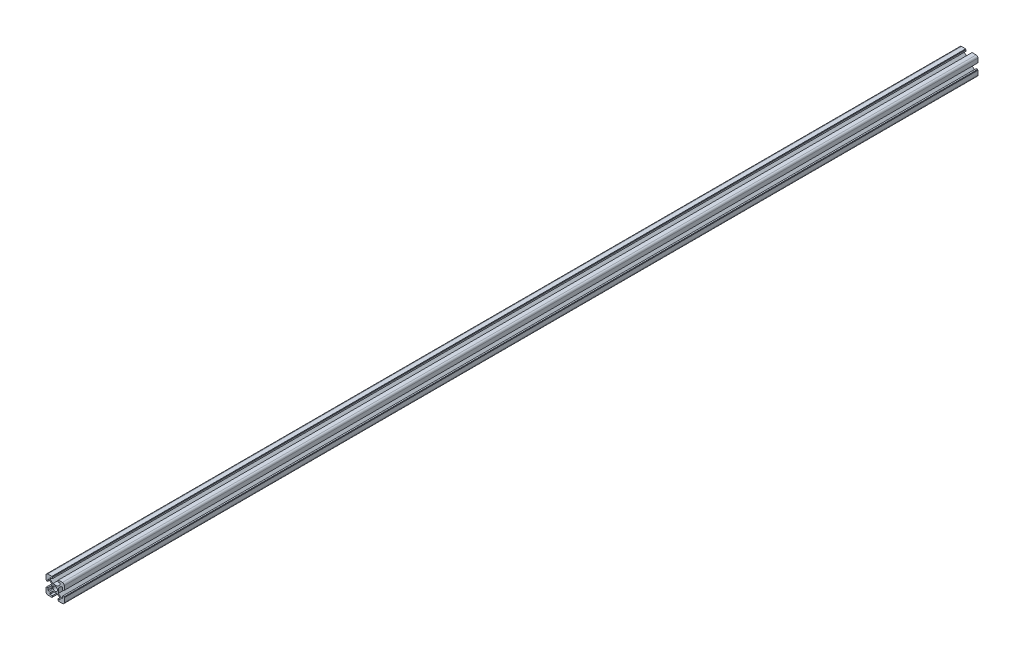
from build123d import *

# Parameters (mm, degrees)
SKETCH1_R           = 2.5
BOSS_EXTRUDE1_DEPTH = 1000


with BuildPart() as part:
    # Sketch1 → Boss-Extrude1 (new body)
    with BuildSketch(Plane.XY):
        with BuildLine():
            Line((8, -3), (8, -5.5))
            Line((8, -5.5), (6.560660172, -5.5))
            Line((6.560660172, -5.5), (3.6, -2.539339828))
            Line((3.6, -2.539339828), (3.6, 2.539339828))
            Line((3.6, 2.539339828), (6.560660172, 5.5))
            Line((6.560660172, 5.5), (8, 5.5))
            Line((8, 5.5), (8, 3))
            Line((8, 3), (9.5, 3))
            Line((9.5, 3), (9.5, 3.5))
            Line((9.5, 3.5), (10, 3.5))
            Line((10, 3.5), (10, 8))
            ThreePointArc((10, 8), (9.414213562, 9.414213562), (8, 10))
            Line((8, 10), (3.5, 10))
            Line((3.5, 10), (3.5, 9.5))
            Line((3.5, 9.5), (3, 9.5))
            Line((3, 9.5), (3, 8))
            Line((3, 8), (5.5, 8))
            Line((5.5, 8), (5.5, 6.560660172))
            Line((5.5, 6.560660172), (2.539339828, 3.6))
            Line((2.539339828, 3.6), (-2.539339828, 3.6))
            Line((-2.539339828, 3.6), (-5.5, 6.560660172))
            Line((-5.5, 6.560660172), (-5.5, 8))
            Line((-5.5, 8), (-3, 8))
            Line((-3, 8), (-3, 9.5))
            Line((-3, 9.5), (-3.5, 9.5))
            Line((-3.5, 9.5), (-3.5, 10))
            Line((-3.5, 10), (-8, 10))
            ThreePointArc((-8, 10), (-9.414213562, 9.414213562), (-10, 8))
            Line((-10, 8), (-10, 3.5))
            Line((-10, 3.5), (-9.5, 3.5))
            Line((-9.5, 3.5), (-9.5, 3))
            Line((-9.5, 3), (-8, 3))
            Line((-8, 3), (-8, 5.5))
            Line((-8, 5.5), (-6.560660172, 5.5))
            Line((-6.560660172, 5.5), (-3.6, 2.539339828))
            Line((-3.6, 2.539339828), (-3.6, -2.539339828))
            Line((-3.6, -2.539339828), (-6.560660172, -5.5))
            Line((-6.560660172, -5.5), (-8, -5.5))
            Line((-8, -5.5), (-8, -3))
            Line((-8, -3), (-9.5, -3))
            Line((-9.5, -3), (-9.5, -3.5))
            Line((-9.5, -3.5), (-10, -3.5))
            Line((-10, -3.5), (-10, -8))
            ThreePointArc((-10, -8), (-9.414213562, -9.414213562), (-8, -10))
            Line((-8, -10), (-3.5, -10))
            Line((-3.5, -10), (-3.5, -9.5))
            Line((-3.5, -9.5), (-3, -9.5))
            Line((-3, -9.5), (-3, -8))
            Line((-3, -8), (-5.5, -8))
            Line((-5.5, -8), (-5.5, -6.560660172))
            Line((-5.5, -6.560660172), (-2.539339828, -3.6))
            Line((-2.539339828, -3.6), (2.539339828, -3.6))
            Line((2.539339828, -3.6), (5.5, -6.560660172))
            Line((5.5, -6.560660172), (5.5, -8))
            Line((5.5, -8), (3, -8))
            Line((3, -8), (3, -9.5))
            Line((3, -9.5), (3.5, -9.5))
            Line((3.5, -9.5), (3.5, -10))
            Line((3.5, -10), (8, -10))
            ThreePointArc((8, -10), (9.414213562, -9.414213562), (10, -8))
            Line((10, -8), (10, -3.5))
            Line((10, -3.5), (9.5, -3.5))
            Line((9.5, -3.5), (9.5, -3))
            Line((9.5, -3), (8, -3))
        make_face()
        Circle(SKETCH1_R, mode=Mode.SUBTRACT)
    extrude(amount=BOSS_EXTRUDE1_DEPTH)


solid = part.part
